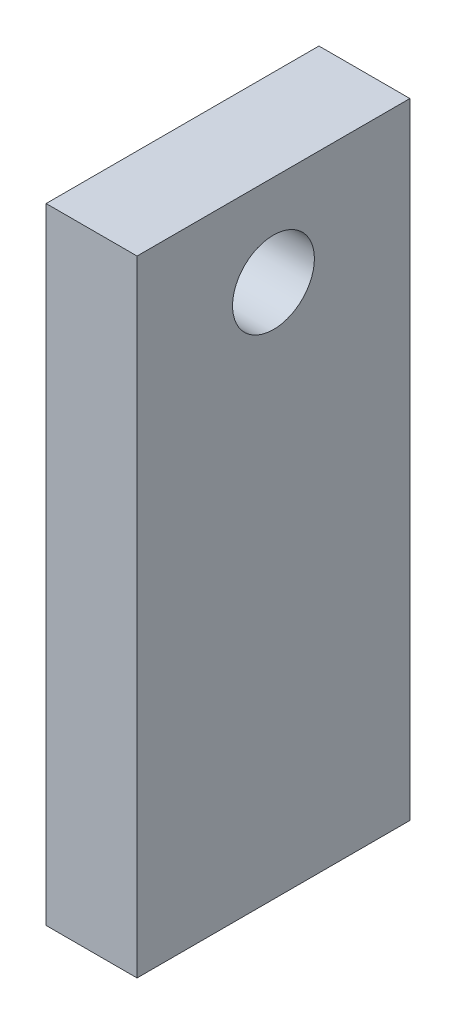
from build123d import *

# Parameters (mm, degrees)
SKETCH1_W           = 300
SKETCH1_H           = 687.5
SKETCH1_R           = 45
BOSS_EXTRUDE1_DEPTH = 100


with BuildPart() as part:
    # Sketch1 → Boss-Extrude1 (new body)
    with BuildSketch(Plane(origin=(0, 0, 0), x_dir=(0, 0, -1), z_dir=(1, 0, 0))):
        Rectangle(SKETCH1_W, SKETCH1_H)
        with Locations((0, 243.75)):
            Circle(SKETCH1_R, mode=Mode.SUBTRACT)
    extrude(amount=BOSS_EXTRUDE1_DEPTH)


solid = part.part
